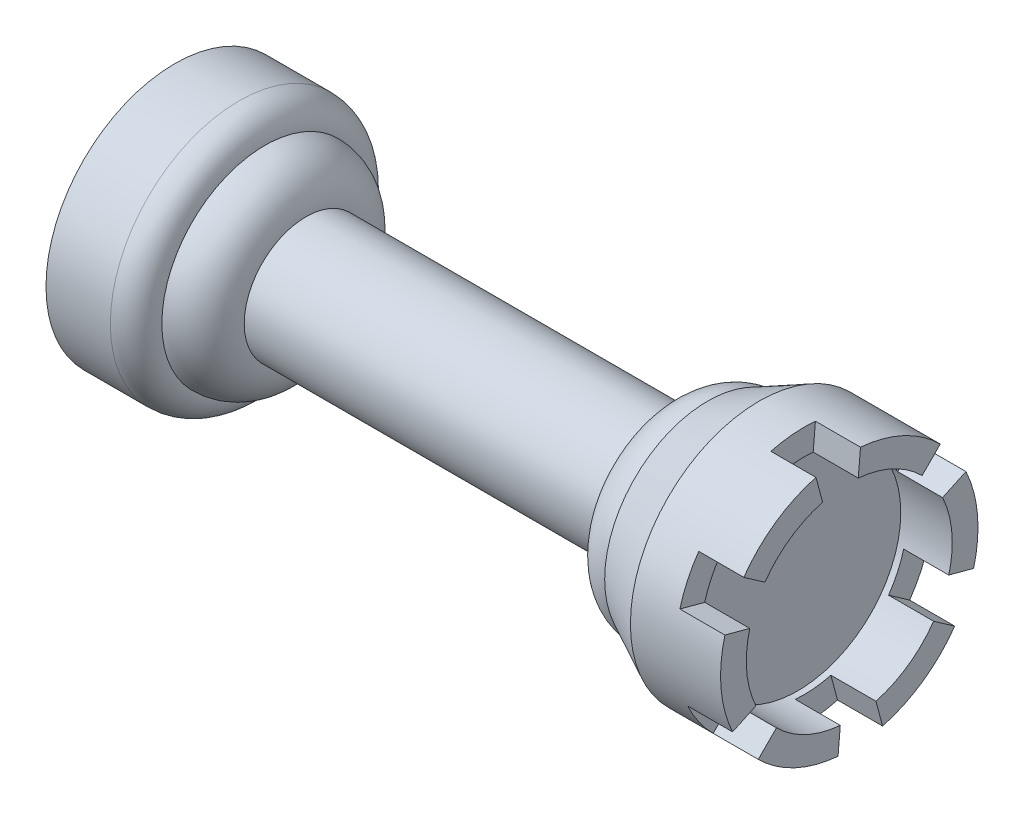
from build123d import *

# Parameters (mm, degrees)
SKETCH_1708_W       = 7
SKETCH_1708_H       = 10
SKETCH_18_R         = 8
CUT_EXTRUDE_4_DEPTH = 4
CUT_EXTRUDE_5_DEPTH = 3.5


with BuildPart() as part:
    # Sketch 917 → Повернуть4 (revolve)
    with BuildSketch(Plane.XY, mode=Mode.PRIVATE) as revolve_4_sk:
        with BuildLine():
            Line((10.2, 4.8), (38.2, 4.8))
            ThreePointArc((38.2, 4.8), (39.1372583, 7.0627417), (41.4, 8))
            Line((41.4, 8), (45.4, 10))
            Line((45.4, 10), (45.4, 0))
            Line((45.4, 0), (10.2, 0))
            Line((10.2, 0), (10.2, 4.8))
        make_face()
    revolve(revolve_4_sk.sketch.rotate(Axis((10.2, 0, 0), (1, 0, 0)), 90), axis=Axis((10.2, 0, 0), (1, 0, 0)))

    # Sketch 1708 → Повернуть7 (revolve)
    with BuildSketch(Plane.XY, mode=Mode.PRIVATE) as revolve_7_sk:
        with Locations((48.9, 5)):
            Rectangle(SKETCH_1708_W, SKETCH_1708_H)
    revolve(revolve_7_sk.sketch.rotate(Axis((52.4, 0, 0), (-1, 0, 0)), 90), axis=Axis((52.4, 0, 0), (-1, 0, 0)))

    # Эскиз18 → Вырез-Вытянуть4 (cut)
    with BuildSketch(Plane(origin=(52.4, 0, 0), x_dir=(0, 0, -1), z_dir=(1, 0, 0))):
        Circle(SKETCH_18_R)
    extrude(amount=-CUT_EXTRUDE_4_DEPTH, mode=Mode.SUBTRACT)

    # Эскиз19 → Вырез-Вытянуть5 (cut)
    with BuildSketch(Plane(origin=(52.4, 0, 0), x_dir=(0, 0, -1), z_dir=(1, 0, 0))):
        with BuildLine():
            Line((-8.191520443, 5.735764364), (-6.553216354, 4.588611491))
            ThreePointArc((-6.553216354, 4.588611491), (-7.250462296, 3.380946094), (-7.72740661, 2.070552361))
            Line((-7.72740661, 2.070552361), (-9.659258263, 2.588190451))
            ThreePointArc((-9.659258263, 2.588190451), (-9.06307787, 4.226182617), (-8.191520443, 5.735764364))
        make_face()
        with BuildLine():
            Line((-2.588190451, 9.659258263), (-2.070552361, 7.72740661))
            ThreePointArc((-2.070552361, 7.72740661), (-0.697245942, 7.969557585), (0.697245942, 7.969557585))
            Line((0.697245942, 7.969557585), (0.871557427, 9.961946981))
            ThreePointArc((0.871557427, 9.961946981), (-0.871557427, 9.961946981), (-2.588190451, 9.659258263))
        make_face()
        with BuildLine():
            Line((7.071067812, 7.071067812), (5.656854249, 5.656854249))
            ThreePointArc((5.656854249, 5.656854249), (6.553216354, 4.588611491), (7.250462296, 3.380946094))
            Line((7.250462296, 3.380946094), (9.06307787, 4.226182617))
            ThreePointArc((9.06307787, 4.226182617), (8.191520443, 5.735764364), (7.071067812, 7.071067812))
        make_face()
        with BuildLine():
            Line((9.659258263, -2.588190451), (7.72740661, -2.070552361))
            ThreePointArc((7.72740661, -2.070552361), (7.250462296, -3.380946094), (6.553216354, -4.588611491))
            Line((6.553216354, -4.588611491), (8.191520443, -5.735764364))
            ThreePointArc((8.191520443, -5.735764364), (9.06307787, -4.226182617), (9.659258263, -2.588190451))
        make_face()
        with BuildLine():
            Line((2.588190451, -9.659258263), (2.070552361, -7.72740661))
            ThreePointArc((2.070552361, -7.72740661), (0.697245942, -7.969557585), (-0.697245942, -7.969557585))
            Line((-0.697245942, -7.969557585), (-0.871557427, -9.961946981))
            ThreePointArc((-0.871557427, -9.961946981), (0.871557427, -9.961946981), (2.588190451, -9.659258263))
        make_face()
        with BuildLine():
            Line((-7.071067812, -7.071067812), (-5.656854249, -5.656854249))
            ThreePointArc((-5.656854249, -5.656854249), (-6.553216354, -4.588611491), (-7.250462296, -3.380946094))
            Line((-7.250462296, -3.380946094), (-9.06307787, -4.226182617))
            ThreePointArc((-9.06307787, -4.226182617), (-8.191520443, -5.735764364), (-7.071067812, -7.071067812))
        make_face()
    extrude(amount=-CUT_EXTRUDE_5_DEPTH, mode=Mode.SUBTRACT)


with BuildPart() as body_2:
    # Sketch 177 → Повернуть6 (revolve)
    with BuildSketch(Plane.XY, mode=Mode.PRIVATE) as revolve_6_sk:
        Polygon((0, 10), (0, 0), (1, 0), (1, 5.25), (3.5, 5.25), (3.5, 0), (5, 0), (5, 10), align=None)
        with BuildLine():
            ThreePointArc((7, 8), (6.414213562, 9.414213562), (5, 10))
            Line((5, 10), (5, 0))
            Line((5, 0), (7, 0))
            Line((7, 0), (7, 8))
        make_face()
        with BuildLine():
            ThreePointArc((10.2, 4.8), (9.2627417, 7.0627417), (7, 8))
            Line((7, 8), (7, 0))
            Line((7, 0), (10.2, 0))
            Line((10.2, 0), (10.2, 4.8))
        make_face()
    revolve(revolve_6_sk.sketch.rotate(Axis((0, 0, 0), (1, 0, 0)), 90), axis=Axis((0, 0, 0), (1, 0, 0)))


solid = Compound([part.part, body_2.part])
